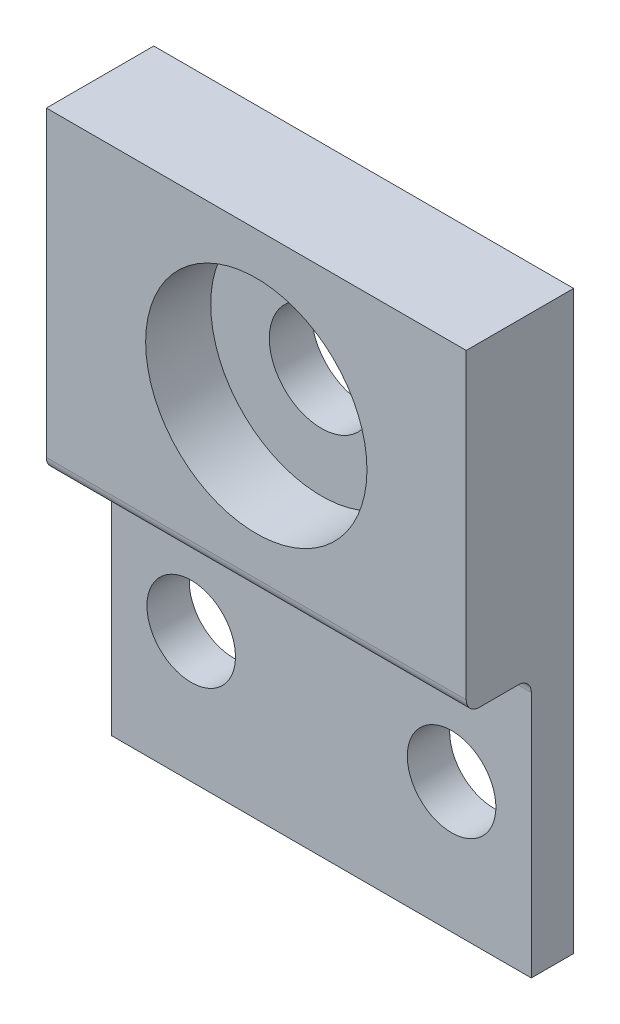
from build123d import *

# Parameters (mm, degrees)
SKETCH1_W           = 32.25
SKETCH1_H           = 44.25
SKETCH1_R           = 3.400367627
SKETCH1_R_2         = 4
BOSS_EXTRUDE1_DEPTH = 3.25
SKETCH1_3_W         = 32.25
SKETCH1_3_H         = 24.25
SKETCH1_3_R         = 8.5
BOSS_EXTRUDE2_DEPTH = 8.25
FILLET1_R           = 1


with BuildPart() as part:
    # Sketch1 → Boss-Extrude1 (new body)
    with BuildSketch(Plane.XY):
        with Locations((16.125, 22.125)):
            Rectangle(SKETCH1_W, SKETCH1_H)
        with Locations((6.125, 10)):
            Circle(SKETCH1_R, mode=Mode.SUBTRACT)
        with Locations((26.125, 10)):
            Circle(SKETCH1_R, mode=Mode.SUBTRACT)
        with Locations((16.125, 32.5)):
            Circle(SKETCH1_R_2, mode=Mode.SUBTRACT)
    extrude(amount=BOSS_EXTRUDE1_DEPTH)

    # Sketch1<3> → Boss-Extrude2 (add)
    with BuildSketch(Plane.XY):
        with Locations((16.125, 32.125)):
            Rectangle(SKETCH1_3_W, SKETCH1_3_H)
        with Locations((16.125, 32.5)):
            Circle(SKETCH1_3_R, mode=Mode.SUBTRACT)
    extrude(amount=BOSS_EXTRUDE2_DEPTH)

    # Fillet1
    fillet1_edges = [part.edges().sort_by_distance(p)[0] for p in [
        (16.125, 20, 8.25),
        (16.125, 20, 3.25),
    ]]
    fillet(fillet1_edges, radius=FILLET1_R)


solid = part.part
